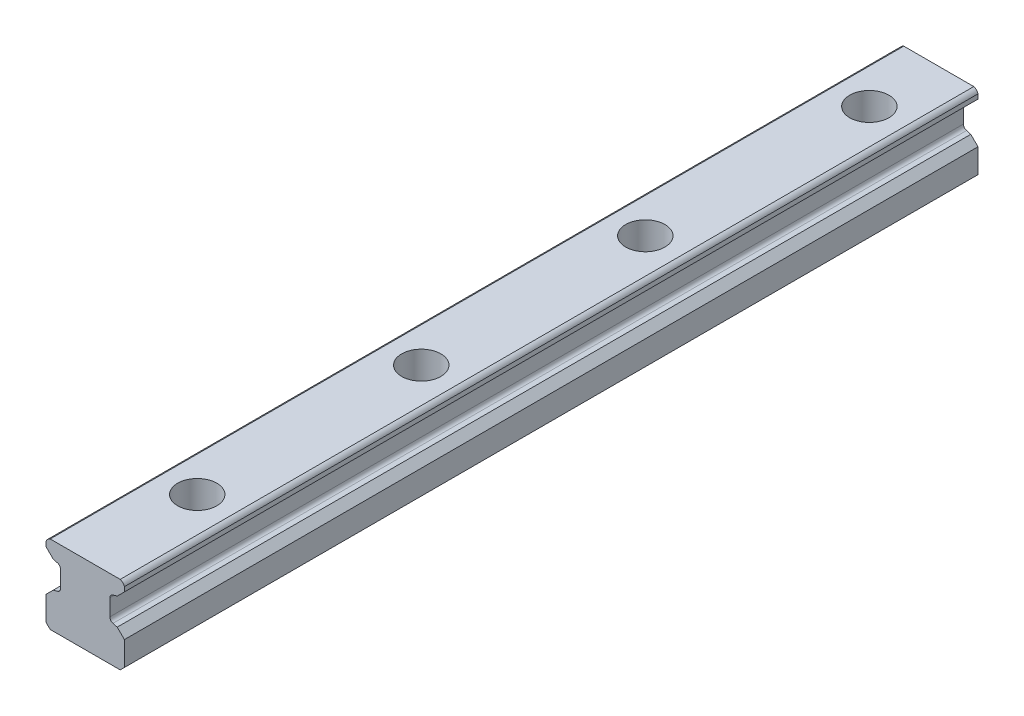
from build123d import *

# Parameters (mm, degrees)
BOSS_EXTRUDE1_DEPTH     = 760
LPATTERN1_COUNT         = 2
LPATTERN1_PITCH         = 80
LPATTERN2_COUNT         = 9
LPATTERN2_PITCH         = 160
CUT_EXTRUDE1_DEPTH      = 40
CUT_EXTRUDE1_DEPTH_BACK = 20
SKETCH5_W               = 307.175258626
SKETCH5_H               = 1220.849909684


with BuildPart() as part:
    # Sketch1 → Boss-Extrude1 (new, symmetric)
    with BuildSketch(Plane.XY):
        with BuildLine():
            Line((-9.911771432, 13.106808119), (-11.43, 12.7))
            Line((-11.43, 12.7), (-14, 10.13))
            Line((-14, 10.13), (-14, 1.5))
            Line((-14, 1.5), (-12.5, 0))
            Line((-12.5, 0), (12.5, 0))
            Line((12.5, 0), (14, 1.5))
            Line((14, 1.5), (14, 10.13))
            Line((14, 10.13), (11.43, 12.7))
            Line((11.43, 12.7), (9.911771432, 13.106808119))
            ThreePointArc((9.911771432, 13.106808119), (9.10996999, 13.642554715), (8.8, 14.555696858))
            Line((8.8, 14.555696858), (8.8, 20.444303142))
            ThreePointArc((8.8, 20.444303142), (9.10996999, 21.357445285), (9.911771432, 21.893191881))
            Line((9.911771432, 21.893191881), (11.43, 22.3))
            Line((11.43, 22.3), (14, 24.87))
            Line((14, 24.87), (14, 26.5))
            ThreePointArc((14, 26.5), (13.416985894, 27.416985894), (12.5, 28))
            Line((12.5, 28), (-12.5, 28))
            ThreePointArc((-12.5, 28), (-13.416985894, 27.416985894), (-14, 26.5))
            Line((-14, 26.5), (-14, 24.87))
            Line((-14, 24.87), (-11.43, 22.3))
            Line((-11.43, 22.3), (-9.911771432, 21.893191881))
            ThreePointArc((-9.911771432, 21.893191881), (-9.10996999, 21.357445285), (-8.8, 20.444303142))
            Line((-8.8, 20.444303142), (-8.8, 14.555696858))
            ThreePointArc((-8.8, 14.555696858), (-9.10996999, 13.642554715), (-9.911771432, 13.106808119))
        make_face()
    extrude(amount=BOSS_EXTRUDE1_DEPTH, both=True)

    # Sketch2 → Cut-Revolve1 (revolve, cut)
    with BuildSketch(Plane(origin=(0, 0, 0), x_dir=(0, 0, -1), z_dir=(1, 0, 0)), mode=Mode.PRIVATE) as cut_revolve1_sk:
        Polygon((-720, 28), (-713, 28), (-713, 16), (-715.5, 16), (-715.5, 0), (-720, 0), align=None)
    cut_revolve1 = revolve(cut_revolve1_sk.sketch.rotate(Axis((0, 28, 720), (0, -1, 0)), 180), axis=Axis((0, 28, 720), (0, -1, 0)), mode=Mode.SUBTRACT)

    # LPattern1: Cut-Revolve1 ×2
    with Locations(*[(0, 0, -i * LPATTERN1_PITCH) for i in range(1, LPATTERN1_COUNT)]):
        add(cut_revolve1, mode=Mode.SUBTRACT)

    # Mirror1: Cut-Revolve1 across plane
    add(cut_revolve1.mirror(Plane.XY), mode=Mode.SUBTRACT)

    # Mirror1 copy 1 sketch → Mirror1 copy 1 (revolve, cut)
    with BuildSketch(Plane(origin=(0, 0, 80), x_dir=(0, 0, 1), z_dir=(1, 0, 0))):
        Polygon((-720, -28), (-713, -28), (-713, -16), (-715.5, -16), (-715.5, 0), (-720, 0), align=None)
    revolve(axis=Axis((0, 28, -640), (0, 1, 0)), mode=Mode.SUBTRACT)

    # LPattern2: Cut-Revolve1 ×9
    with Locations(*[(0, 0, -i * LPATTERN2_PITCH) for i in range(1, LPATTERN2_COUNT)]):
        add(cut_revolve1, mode=Mode.SUBTRACT)

    # LPattern2 copy 1 sketch → LPattern2 copy 1 (revolve, cut)
    with BuildSketch(Plane(origin=(0, 0, -240), x_dir=(0, 0, -1), z_dir=(1, 0, 0))):
        Polygon((-720, 28), (-713, 28), (-713, 16), (-715.5, 16), (-715.5, 0), (-720, 0), align=None)
    revolve(axis=Axis((0, 28, 480), (0, -1, 0)), mode=Mode.SUBTRACT)

    # LPattern2 copy 2 sketch → LPattern2 copy 2 (revolve, cut)
    with BuildSketch(Plane(origin=(0, 0, -400), x_dir=(0, 0, -1), z_dir=(1, 0, 0))):
        Polygon((-720, 28), (-713, 28), (-713, 16), (-715.5, 16), (-715.5, 0), (-720, 0), align=None)
    revolve(axis=Axis((0, 28, 320), (0, -1, 0)), mode=Mode.SUBTRACT)

    # LPattern2 copy 3 sketch → LPattern2 copy 3 (revolve, cut)
    with BuildSketch(Plane(origin=(0, 0, -560), x_dir=(0, 0, -1), z_dir=(1, 0, 0))):
        Polygon((-720, 28), (-713, 28), (-713, 16), (-715.5, 16), (-715.5, 0), (-720, 0), align=None)
    revolve(axis=Axis((0, 28, 160), (0, -1, 0)), mode=Mode.SUBTRACT)

    # LPattern2 copy 4 sketch → LPattern2 copy 4 (revolve, cut)
    with BuildSketch(Plane(origin=(0, 0, -720), x_dir=(0, 0, -1), z_dir=(1, 0, 0))):
        Polygon((-720, 28), (-713, 28), (-713, 16), (-715.5, 16), (-715.5, 0), (-720, 0), align=None)
    revolve(axis=Axis((0, 28, 0), (0, -1, 0)), mode=Mode.SUBTRACT)

    # LPattern2 copy 5 sketch → LPattern2 copy 5 (revolve, cut)
    with BuildSketch(Plane(origin=(0, 0, -880), x_dir=(0, 0, -1), z_dir=(1, 0, 0))):
        Polygon((-720, 28), (-713, 28), (-713, 16), (-715.5, 16), (-715.5, 0), (-720, 0), align=None)
    revolve(axis=Axis((0, 28, -160), (0, -1, 0)), mode=Mode.SUBTRACT)

    # LPattern2 copy 6 sketch → LPattern2 copy 6 (revolve, cut)
    with BuildSketch(Plane(origin=(0, 0, -1040), x_dir=(0, 0, -1), z_dir=(1, 0, 0))):
        Polygon((-720, 28), (-713, 28), (-713, 16), (-715.5, 16), (-715.5, 0), (-720, 0), align=None)
    revolve(axis=Axis((0, 28, -320), (0, -1, 0)), mode=Mode.SUBTRACT)

    # LPattern2 copy 7 sketch → LPattern2 copy 7 (revolve, cut)
    with BuildSketch(Plane(origin=(0, 0, -1200), x_dir=(0, 0, -1), z_dir=(1, 0, 0))):
        Polygon((-720, 28), (-713, 28), (-713, 16), (-715.5, 16), (-715.5, 0), (-720, 0), align=None)
    revolve(axis=Axis((0, 28, -480), (0, -1, 0)), mode=Mode.SUBTRACT)

    # LPattern2 copy 8 sketch → LPattern2 copy 8 (revolve, cut)
    with BuildSketch(Plane(origin=(0, 0, -1360), x_dir=(0, 0, -1), z_dir=(1, 0, 0))):
        Polygon((-720, 28), (-713, 28), (-713, 16), (-715.5, 16), (-715.5, 0), (-720, 0), align=None)
    revolve(axis=Axis((0, 28, -640), (0, -1, 0)), mode=Mode.SUBTRACT)

    # Sketch5 → Cut-Extrude1 (cut, two sides: drawn at the far end of the back side and taken through both)
    with BuildSketch(Plane(origin=(0, 0, 0), x_dir=(1, 0, 0), z_dir=(0, 1, 0)).offset(-CUT_EXTRUDE1_DEPTH_BACK)):
        with Locations((39.746319407, 155.224954842)):
            Rectangle(SKETCH5_W, SKETCH5_H)
    extrude(amount=CUT_EXTRUDE1_DEPTH + CUT_EXTRUDE1_DEPTH_BACK, mode=Mode.SUBTRACT)


solid = part.part
